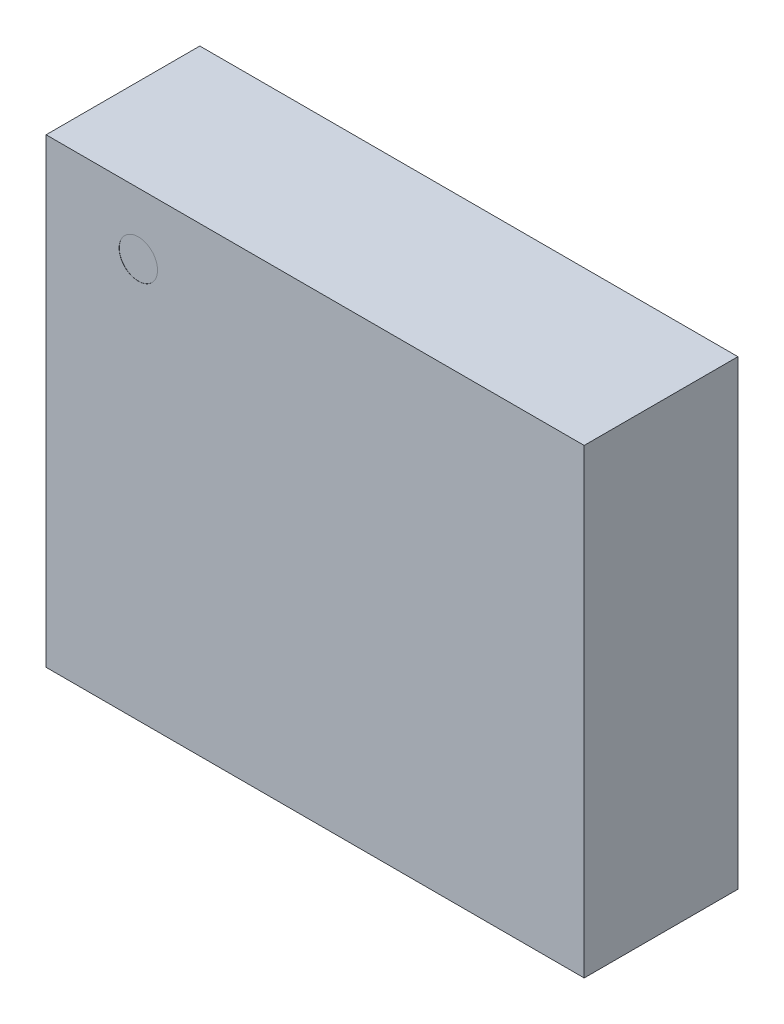
from build123d import *

# Parameters (mm, degrees)
SKETCH1_W                   = 3.5
SKETCH1_H                   = 3
BOSS_EXTRUDE1_DEPTH         = 1
BOSS_EXTRUDE2_DEPTH         = 0.001
BOSS_EXTRUDE2_DEPTH_BACK    = 0.13
SKETCH2_W                   = 0.23
SKETCH2_H                   = 0.35
BOSS_EXTRUDE2_2_DEPTH       = 0.001
BOSS_EXTRUDE2_2_DEPTH_BACK  = 0.13
BOSS_EXTRUDE2_3_DEPTH       = 0.001
BOSS_EXTRUDE2_3_DEPTH_BACK  = 0.13
BOSS_EXTRUDE2_4_DEPTH       = 0.001
BOSS_EXTRUDE2_4_DEPTH_BACK  = 0.13
BOSS_EXTRUDE2_5_DEPTH       = 0.001
BOSS_EXTRUDE2_5_DEPTH_BACK  = 0.13
BOSS_EXTRUDE2_6_DEPTH       = 0.001
BOSS_EXTRUDE2_6_DEPTH_BACK  = 0.13
BOSS_EXTRUDE2_7_DEPTH       = 0.001
BOSS_EXTRUDE2_7_DEPTH_BACK  = 0.13
BOSS_EXTRUDE2_8_DEPTH       = 0.001
BOSS_EXTRUDE2_8_DEPTH_BACK  = 0.13
BOSS_EXTRUDE2_9_DEPTH       = 0.001
BOSS_EXTRUDE2_9_DEPTH_BACK  = 0.13
BOSS_EXTRUDE2_10_DEPTH      = 0.001
BOSS_EXTRUDE2_10_DEPTH_BACK = 0.13
BOSS_EXTRUDE2_11_DEPTH      = 0.001
BOSS_EXTRUDE2_11_DEPTH_BACK = 0.13
BOSS_EXTRUDE2_12_DEPTH      = 0.001
BOSS_EXTRUDE2_12_DEPTH_BACK = 0.13
BOSS_EXTRUDE2_13_DEPTH      = 0.001
BOSS_EXTRUDE2_13_DEPTH_BACK = 0.13
BOSS_EXTRUDE2_14_DEPTH      = 0.001
BOSS_EXTRUDE2_14_DEPTH_BACK = 0.13
BOSS_EXTRUDE2_15_DEPTH      = 0.001
BOSS_EXTRUDE2_15_DEPTH_BACK = 0.13
BOSS_EXTRUDE2_16_DEPTH      = 0.001
BOSS_EXTRUDE2_16_DEPTH_BACK = 0.13
BOSS_EXTRUDE2_17_DEPTH      = 0.001
BOSS_EXTRUDE2_17_DEPTH_BACK = 0.13
SKETCH2_W_2                 = 0.35
SKETCH2_H_2                 = 0.23
BOSS_EXTRUDE2_18_DEPTH      = 0.001
BOSS_EXTRUDE2_18_DEPTH_BACK = 0.13
BOSS_EXTRUDE2_19_DEPTH      = 0.001
BOSS_EXTRUDE2_19_DEPTH_BACK = 0.13
BOSS_EXTRUDE2_20_DEPTH      = 0.001
BOSS_EXTRUDE2_20_DEPTH_BACK = 0.13
BOSS_EXTRUDE2_21_DEPTH      = 0.001
BOSS_EXTRUDE2_21_DEPTH_BACK = 0.13
BOSS_EXTRUDE2_22_DEPTH      = 0.001
BOSS_EXTRUDE2_22_DEPTH_BACK = 0.13
BOSS_EXTRUDE2_23_DEPTH      = 0.001
BOSS_EXTRUDE2_23_DEPTH_BACK = 0.13
BOSS_EXTRUDE2_24_DEPTH      = 0.001
BOSS_EXTRUDE2_24_DEPTH_BACK = 0.13
SKETCH3_R                   = 0.125
CUT_EXTRUDE1_DEPTH          = 0.001


with BuildPart() as part:
    # Sketch1 → Boss-Extrude1 (new body)
    with BuildSketch(Plane.XY):
        Rectangle(SKETCH1_W, SKETCH1_H)
    extrude(amount=BOSS_EXTRUDE1_DEPTH)

    # Sketch3 → Cut-Extrude1 (cut)
    with BuildSketch(Plane.XY.offset(1)):
        with Locations((-1.15, 1.1)):
            Circle(SKETCH3_R)
    extrude(amount=-CUT_EXTRUDE1_DEPTH, mode=Mode.SUBTRACT)


with BuildPart() as body_2:
    # Sketch2 → Boss-Extrude2 (new, two sides: drawn at the far end of the back side and taken through both)
    with BuildSketch(Plane(origin=(0, 0, 0), x_dir=(-1, 0, 0), z_dir=(0, 0, -1)).offset(-BOSS_EXTRUDE2_DEPTH_BACK)):
        with Locations((-0.215, 1.225)):
            Rectangle(SKETCH2_W, SKETCH2_H)
    extrude(amount=BOSS_EXTRUDE2_DEPTH + BOSS_EXTRUDE2_DEPTH_BACK)


with BuildPart() as body_3:
    # Sketch2 → Boss-Extrude2 2 (new, two sides: drawn at the far end of the back side and taken through both)
    with BuildSketch(Plane(origin=(0, 0, 0), x_dir=(-1, 0, 0), z_dir=(0, 0, -1)).offset(-BOSS_EXTRUDE2_2_DEPTH_BACK)):
        with Locations((-0.645, 1.225)):
            Rectangle(SKETCH2_W, SKETCH2_H)
    extrude(amount=BOSS_EXTRUDE2_2_DEPTH + BOSS_EXTRUDE2_2_DEPTH_BACK)


with BuildPart() as body_4:
    # Sketch2 → Boss-Extrude2 3 (new, two sides: drawn at the far end of the back side and taken through both)
    with BuildSketch(Plane(origin=(0, 0, 0), x_dir=(-1, 0, 0), z_dir=(0, 0, -1)).offset(-BOSS_EXTRUDE2_3_DEPTH_BACK)):
        with Locations((-1.075, 1.225)):
            Rectangle(SKETCH2_W, SKETCH2_H)
    extrude(amount=BOSS_EXTRUDE2_3_DEPTH + BOSS_EXTRUDE2_3_DEPTH_BACK)


with BuildPart() as body_5:
    # Sketch2 → Boss-Extrude2 4 (new, two sides: drawn at the far end of the back side and taken through both)
    with BuildSketch(Plane(origin=(0, 0, 0), x_dir=(-1, 0, 0), z_dir=(0, 0, -1)).offset(-BOSS_EXTRUDE2_4_DEPTH_BACK)):
        with Locations((-1.505, 1.225)):
            Rectangle(SKETCH2_W, SKETCH2_H)
    extrude(amount=BOSS_EXTRUDE2_4_DEPTH + BOSS_EXTRUDE2_4_DEPTH_BACK)


with BuildPart() as body_6:
    # Sketch2 → Boss-Extrude2 5 (new, two sides: drawn at the far end of the back side and taken through both)
    with BuildSketch(Plane(origin=(0, 0, 0), x_dir=(-1, 0, 0), z_dir=(0, 0, -1)).offset(-BOSS_EXTRUDE2_5_DEPTH_BACK)):
        with Locations((0.215, 1.225)):
            Rectangle(SKETCH2_W, SKETCH2_H)
    extrude(amount=BOSS_EXTRUDE2_5_DEPTH + BOSS_EXTRUDE2_5_DEPTH_BACK)


with BuildPart() as body_7:
    # Sketch2 → Boss-Extrude2 6 (new, two sides: drawn at the far end of the back side and taken through both)
    with BuildSketch(Plane(origin=(0, 0, 0), x_dir=(-1, 0, 0), z_dir=(0, 0, -1)).offset(-BOSS_EXTRUDE2_6_DEPTH_BACK)):
        with Locations((0.645, 1.225)):
            Rectangle(SKETCH2_W, SKETCH2_H)
    extrude(amount=BOSS_EXTRUDE2_6_DEPTH + BOSS_EXTRUDE2_6_DEPTH_BACK)


with BuildPart() as body_8:
    # Sketch2 → Boss-Extrude2 7 (new, two sides: drawn at the far end of the back side and taken through both)
    with BuildSketch(Plane(origin=(0, 0, 0), x_dir=(-1, 0, 0), z_dir=(0, 0, -1)).offset(-BOSS_EXTRUDE2_7_DEPTH_BACK)):
        with Locations((1.075, 1.225)):
            Rectangle(SKETCH2_W, SKETCH2_H)
    extrude(amount=BOSS_EXTRUDE2_7_DEPTH + BOSS_EXTRUDE2_7_DEPTH_BACK)


with BuildPart() as body_9:
    # Sketch2 → Boss-Extrude2 8 (new, two sides: drawn at the far end of the back side and taken through both)
    with BuildSketch(Plane(origin=(0, 0, 0), x_dir=(-1, 0, 0), z_dir=(0, 0, -1)).offset(-BOSS_EXTRUDE2_8_DEPTH_BACK)):
        Polygon((1.62, 1.4), (1.39, 1.4), (1.39, 1.05), (1.52, 1.05), (1.62, 1.15), align=None)
    extrude(amount=BOSS_EXTRUDE2_8_DEPTH + BOSS_EXTRUDE2_8_DEPTH_BACK)


with BuildPart() as body_10:
    # Sketch2 → Boss-Extrude2 9 (new, two sides: drawn at the far end of the back side and taken through both)
    with BuildSketch(Plane(origin=(0, 0, 0), x_dir=(-1, 0, 0), z_dir=(0, 0, -1)).offset(-BOSS_EXTRUDE2_9_DEPTH_BACK)):
        with Locations((1.505, -1.225)):
            Rectangle(SKETCH2_W, SKETCH2_H)
    extrude(amount=BOSS_EXTRUDE2_9_DEPTH + BOSS_EXTRUDE2_9_DEPTH_BACK)


with BuildPart() as body_11:
    # Sketch2 → Boss-Extrude2 10 (new, two sides: drawn at the far end of the back side and taken through both)
    with BuildSketch(Plane(origin=(0, 0, 0), x_dir=(-1, 0, 0), z_dir=(0, 0, -1)).offset(-BOSS_EXTRUDE2_10_DEPTH_BACK)):
        with Locations((1.075, -1.225)):
            Rectangle(SKETCH2_W, SKETCH2_H)
    extrude(amount=BOSS_EXTRUDE2_10_DEPTH + BOSS_EXTRUDE2_10_DEPTH_BACK)


with BuildPart() as body_12:
    # Sketch2 → Boss-Extrude2 11 (new, two sides: drawn at the far end of the back side and taken through both)
    with BuildSketch(Plane(origin=(0, 0, 0), x_dir=(-1, 0, 0), z_dir=(0, 0, -1)).offset(-BOSS_EXTRUDE2_11_DEPTH_BACK)):
        with Locations((0.645, -1.225)):
            Rectangle(SKETCH2_W, SKETCH2_H)
    extrude(amount=BOSS_EXTRUDE2_11_DEPTH + BOSS_EXTRUDE2_11_DEPTH_BACK)


with BuildPart() as body_13:
    # Sketch2 → Boss-Extrude2 12 (new, two sides: drawn at the far end of the back side and taken through both)
    with BuildSketch(Plane(origin=(0, 0, 0), x_dir=(-1, 0, 0), z_dir=(0, 0, -1)).offset(-BOSS_EXTRUDE2_12_DEPTH_BACK)):
        with Locations((0.215, -1.225)):
            Rectangle(SKETCH2_W, SKETCH2_H)
    extrude(amount=BOSS_EXTRUDE2_12_DEPTH + BOSS_EXTRUDE2_12_DEPTH_BACK)


with BuildPart() as body_14:
    # Sketch2 → Boss-Extrude2 13 (new, two sides: drawn at the far end of the back side and taken through both)
    with BuildSketch(Plane(origin=(0, 0, 0), x_dir=(-1, 0, 0), z_dir=(0, 0, -1)).offset(-BOSS_EXTRUDE2_13_DEPTH_BACK)):
        with Locations((-0.215, -1.225)):
            Rectangle(SKETCH2_W, SKETCH2_H)
    extrude(amount=BOSS_EXTRUDE2_13_DEPTH + BOSS_EXTRUDE2_13_DEPTH_BACK)


with BuildPart() as body_15:
    # Sketch2 → Boss-Extrude2 14 (new, two sides: drawn at the far end of the back side and taken through both)
    with BuildSketch(Plane(origin=(0, 0, 0), x_dir=(-1, 0, 0), z_dir=(0, 0, -1)).offset(-BOSS_EXTRUDE2_14_DEPTH_BACK)):
        with Locations((-0.645, -1.225)):
            Rectangle(SKETCH2_W, SKETCH2_H)
    extrude(amount=BOSS_EXTRUDE2_14_DEPTH + BOSS_EXTRUDE2_14_DEPTH_BACK)


with BuildPart() as body_16:
    # Sketch2 → Boss-Extrude2 15 (new, two sides: drawn at the far end of the back side and taken through both)
    with BuildSketch(Plane(origin=(0, 0, 0), x_dir=(-1, 0, 0), z_dir=(0, 0, -1)).offset(-BOSS_EXTRUDE2_15_DEPTH_BACK)):
        with Locations((-1.075, -1.225)):
            Rectangle(SKETCH2_W, SKETCH2_H)
    extrude(amount=BOSS_EXTRUDE2_15_DEPTH + BOSS_EXTRUDE2_15_DEPTH_BACK)


with BuildPart() as body_17:
    # Sketch2 → Boss-Extrude2 16 (new, two sides: drawn at the far end of the back side and taken through both)
    with BuildSketch(Plane(origin=(0, 0, 0), x_dir=(-1, 0, 0), z_dir=(0, 0, -1)).offset(-BOSS_EXTRUDE2_16_DEPTH_BACK)):
        with Locations((-1.505, -1.225)):
            Rectangle(SKETCH2_W, SKETCH2_H)
    extrude(amount=BOSS_EXTRUDE2_16_DEPTH + BOSS_EXTRUDE2_16_DEPTH_BACK)


with BuildPart() as body_18:
    # Sketch2 → Boss-Extrude2 17 (new, two sides: drawn at the far end of the back side and taken through both)
    with BuildSketch(Plane(origin=(0, 0, 0), x_dir=(-1, 0, 0), z_dir=(0, 0, -1)).offset(-BOSS_EXTRUDE2_17_DEPTH_BACK)):
        with Locations((-1.475, 0.215)):
            Rectangle(SKETCH2_W_2, SKETCH2_H_2)
    extrude(amount=BOSS_EXTRUDE2_17_DEPTH + BOSS_EXTRUDE2_17_DEPTH_BACK)


with BuildPart() as body_19:
    # Sketch2 → Boss-Extrude2 18 (new, two sides: drawn at the far end of the back side and taken through both)
    with BuildSketch(Plane(origin=(0, 0, 0), x_dir=(-1, 0, 0), z_dir=(0, 0, -1)).offset(-BOSS_EXTRUDE2_18_DEPTH_BACK)):
        with Locations((-1.475, 0.645)):
            Rectangle(SKETCH2_W_2, SKETCH2_H_2)
    extrude(amount=BOSS_EXTRUDE2_18_DEPTH + BOSS_EXTRUDE2_18_DEPTH_BACK)


with BuildPart() as body_20:
    # Sketch2 → Boss-Extrude2 19 (new, two sides: drawn at the far end of the back side and taken through both)
    with BuildSketch(Plane(origin=(0, 0, 0), x_dir=(-1, 0, 0), z_dir=(0, 0, -1)).offset(-BOSS_EXTRUDE2_19_DEPTH_BACK)):
        with Locations((-1.475, -0.215)):
            Rectangle(SKETCH2_W_2, SKETCH2_H_2)
    extrude(amount=BOSS_EXTRUDE2_19_DEPTH + BOSS_EXTRUDE2_19_DEPTH_BACK)


with BuildPart() as body_21:
    # Sketch2 → Boss-Extrude2 20 (new, two sides: drawn at the far end of the back side and taken through both)
    with BuildSketch(Plane(origin=(0, 0, 0), x_dir=(-1, 0, 0), z_dir=(0, 0, -1)).offset(-BOSS_EXTRUDE2_20_DEPTH_BACK)):
        with Locations((-1.475, -0.645)):
            Rectangle(SKETCH2_W_2, SKETCH2_H_2)
    extrude(amount=BOSS_EXTRUDE2_20_DEPTH + BOSS_EXTRUDE2_20_DEPTH_BACK)


with BuildPart() as body_22:
    # Sketch2 → Boss-Extrude2 21 (new, two sides: drawn at the far end of the back side and taken through both)
    with BuildSketch(Plane(origin=(0, 0, 0), x_dir=(-1, 0, 0), z_dir=(0, 0, -1)).offset(-BOSS_EXTRUDE2_21_DEPTH_BACK)):
        with Locations((1.475, -0.645)):
            Rectangle(SKETCH2_W_2, SKETCH2_H_2)
    extrude(amount=BOSS_EXTRUDE2_21_DEPTH + BOSS_EXTRUDE2_21_DEPTH_BACK)


with BuildPart() as body_23:
    # Sketch2 → Boss-Extrude2 22 (new, two sides: drawn at the far end of the back side and taken through both)
    with BuildSketch(Plane(origin=(0, 0, 0), x_dir=(-1, 0, 0), z_dir=(0, 0, -1)).offset(-BOSS_EXTRUDE2_22_DEPTH_BACK)):
        with Locations((1.475, -0.215)):
            Rectangle(SKETCH2_W_2, SKETCH2_H_2)
    extrude(amount=BOSS_EXTRUDE2_22_DEPTH + BOSS_EXTRUDE2_22_DEPTH_BACK)


with BuildPart() as body_24:
    # Sketch2 → Boss-Extrude2 23 (new, two sides: drawn at the far end of the back side and taken through both)
    with BuildSketch(Plane(origin=(0, 0, 0), x_dir=(-1, 0, 0), z_dir=(0, 0, -1)).offset(-BOSS_EXTRUDE2_23_DEPTH_BACK)):
        with Locations((1.475, 0.215)):
            Rectangle(SKETCH2_W_2, SKETCH2_H_2)
    extrude(amount=BOSS_EXTRUDE2_23_DEPTH + BOSS_EXTRUDE2_23_DEPTH_BACK)


with BuildPart() as body_25:
    # Sketch2 → Boss-Extrude2 24 (new, two sides: drawn at the far end of the back side and taken through both)
    with BuildSketch(Plane(origin=(0, 0, 0), x_dir=(-1, 0, 0), z_dir=(0, 0, -1)).offset(-BOSS_EXTRUDE2_24_DEPTH_BACK)):
        with Locations((1.475, 0.645)):
            Rectangle(SKETCH2_W_2, SKETCH2_H_2)
    extrude(amount=BOSS_EXTRUDE2_24_DEPTH + BOSS_EXTRUDE2_24_DEPTH_BACK)


solid = Compound([part.part, body_2.part, body_3.part, body_4.part, body_5.part, body_6.part, body_7.part, body_8.part, body_9.part, body_10.part, body_11.part, body_12.part, body_13.part, body_14.part, body_15.part, body_16.part, body_17.part, body_18.part, body_19.part, body_20.part, body_21.part, body_22.part, body_23.part, body_24.part, body_25.part])
